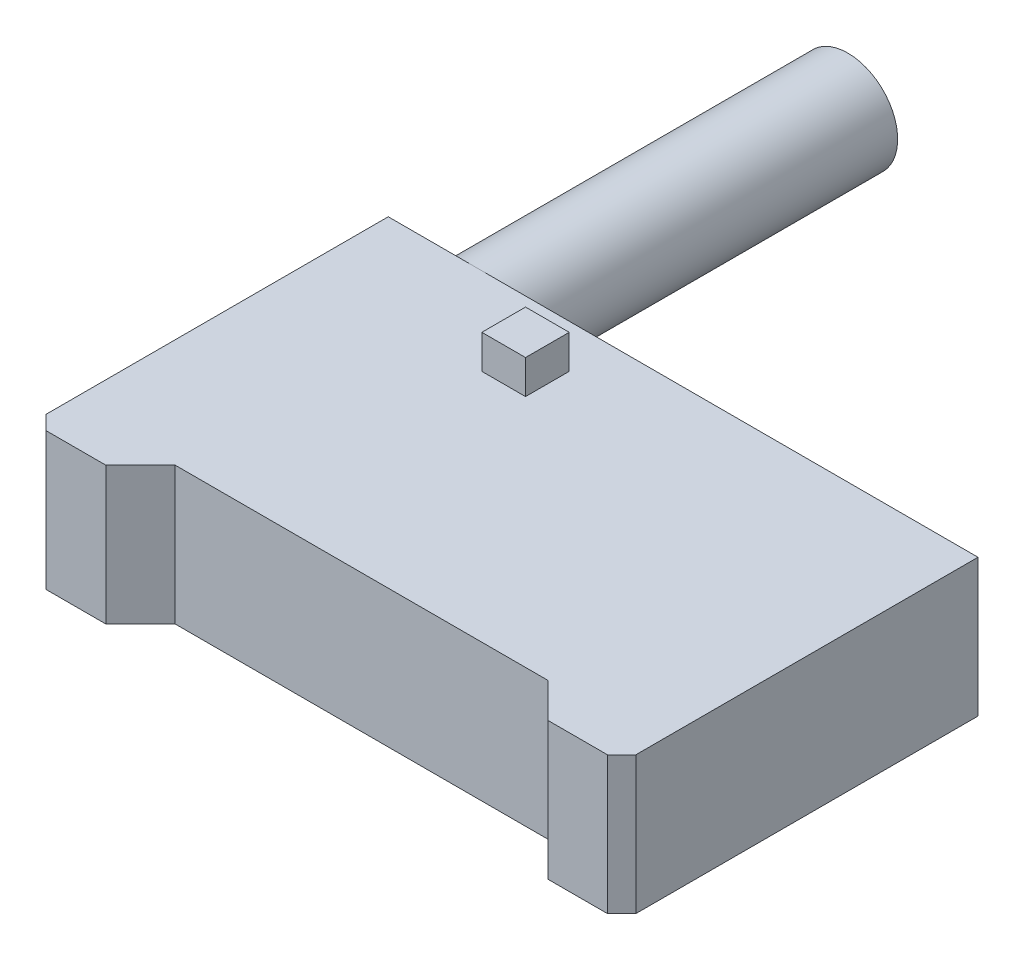
from build123d import *

# Parameters (mm, degrees)
SKETCH2_W           = 53.1368
SKETCH2_H           = 28.9814
SKETCH2_W_2         = 5.3848
SKETCH2_H_2         = 3.1242
BOSS_EXTRUDE1_DEPTH = 12.3952
SKETCH3_R           = 4.4831
BOSS_EXTRUDE2_DEPTH = 33.4772
SKETCH5_W           = 3.937
SKETCH5_H           = 3.937
BOSS_EXTRUDE3_DEPTH = 3.048


with BuildPart() as part:
    # Sketch2 → Boss-Extrude1 (new body)
    with BuildSketch(Plane(origin=(0, 0, 0), x_dir=(1, 0, 0), z_dir=(0, 1, 0))):
        Rectangle(SKETCH2_W, SKETCH2_H)
        Polygon((26.5684, -14.4907), (25.2984, -14.4907), (25.2984, -17.6149), (26.5684, -16.3449), align=None)
        with Locations((22.606, -16.0528)):
            Rectangle(SKETCH2_W_2, SKETCH2_H_2)
        Polygon((19.9136, -14.4907), (16.7894, -14.4907), (19.9136, -17.6149), align=None)
        Polygon((-26.5684, -16.3449), (-25.2984, -17.6149), (-25.2984, -14.4907), (-26.5684, -14.4907), align=None)
        with Locations((-22.606, -16.0528)):
            Rectangle(SKETCH2_W_2, SKETCH2_H_2)
        Polygon((-19.9136, -14.4907), (-19.9136, -17.6149), (-16.7894, -14.4907), align=None)
    extrude(amount=BOSS_EXTRUDE1_DEPTH)

    # Sketch3 → Boss-Extrude2 (add)
    with BuildSketch(Plane(origin=(0, 0, -14.4907), x_dir=(-1, 0, 0), z_dir=(0, 0, -1))):
        with Locations(Location((18.6309, 7.9121, 0), (0, 0, 90))):
            Circle(SKETCH3_R)
    extrude(amount=BOSS_EXTRUDE2_DEPTH)

    # Sketch5 → Boss-Extrude3 (add)
    with BuildSketch(Plane(origin=(0, 12.3952, 0), x_dir=(1, 0, 0), z_dir=(0, 1, 0))):
        with Locations((-8.3185, 8.6106)):
            Rectangle(SKETCH5_W, SKETCH5_H)
    extrude(amount=BOSS_EXTRUDE3_DEPTH)


solid = part.part
